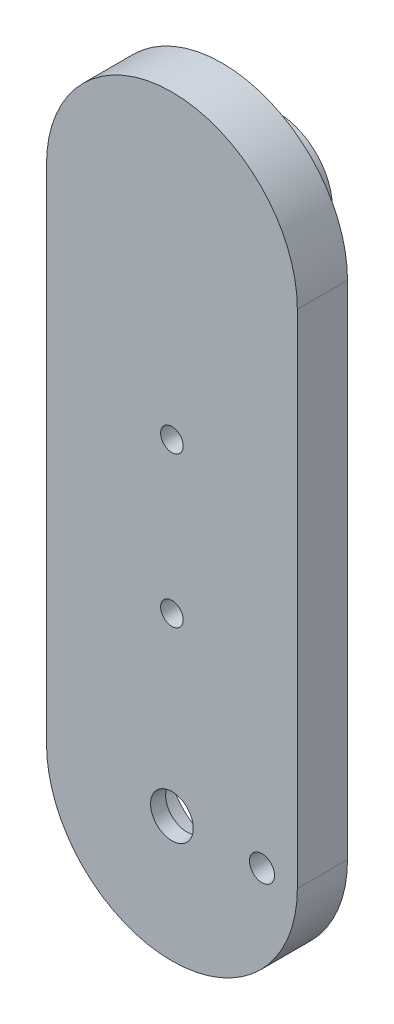
from build123d import *

# Parameters (mm, degrees)
CROQUIS1_R                   = 11
SALIENTE_EXTRUIR1_DEPTH      = 5
SALIENTE_EXTRUIR2_START      = 6
CROQUIS2_R                   = 11
SALIENTE_EXTRUIR2_DEPTH      = 6
CROQUIS3_R                   = 2.25
CORTAR_EXTRUIR1_DEPTH        = 20.052558883
SALIENTE_EXTRUIR3_DEPTH      = 5
SALIENTE_EXTRUIR3_DEPTH_BACK = 5
SALIENTE_EXTRUIR4_DEPTH      = 10
CROQUIS6_R                   = 2.25
CORTAR_EXTRUIR2_DEPTH        = 130.193653111
CROQUIS7_R                   = 10.9
CORTAR_EXTRUIR3_DEPTH        = 7
CROQUIS8_R                   = 4.25
CORTAR_EXTRUIR4_DEPTH        = 129.740048173
CROQUIS9_R                   = 2.5
CORTAR_EXTRUIR5_DEPTH        = 130.193653111


with BuildPart() as part:
    # Croquis1 → Saliente-Extruir1 (new, symmetric)
    with BuildSketch(Plane.XY):
        Circle(CROQUIS1_R)
        with BuildLine():
            Line((1.833030278, 2.5), (-1.833030278, 2.5))
            ThreePointArc((-1.833030278, 2.5), (0, -3.1), (1.833030278, 2.5))
        make_face(mode=Mode.SUBTRACT)
    extrude(amount=SALIENTE_EXTRUIR1_DEPTH, both=True)

    # Croquis2 → Saliente-Extruir2 (add)
    with BuildSketch(Plane.XY.offset(5).offset(SALIENTE_EXTRUIR2_START)):
        Circle(CROQUIS2_R)
    extrude(amount=-SALIENTE_EXTRUIR2_DEPTH)

    # Croquis3 → Cortar-Extruir1 (cut, through all)
    with BuildSketch(Plane(origin=(0, 0, 0), x_dir=(1, 0, 0), z_dir=(0, 1, 0))):
        with Locations(Location((0, 0, 0), (0, 0, 90))):
            Circle(CROQUIS3_R)
    extrude(amount=CORTAR_EXTRUIR1_DEPTH, mode=Mode.SUBTRACT)

    # Croquis4 → Saliente-Extruir3 (add, two sides: drawn at the far end of the back side and taken through both)
    with BuildSketch(Plane.XY.offset(11).offset(-SALIENTE_EXTRUIR3_DEPTH_BACK)):
        with BuildLine():
            Line((-25, 0), (-25, -85))
            Line((-25, -85), (25, -85))
            Line((25, -85), (25, 0))
            ThreePointArc((25, 0), (0, 25), (-25, 0))
        make_face()
    extrude(amount=SALIENTE_EXTRUIR3_DEPTH + SALIENTE_EXTRUIR3_DEPTH_BACK)

    # Croquis5 → Saliente-Extruir4 (add)
    with BuildSketch(Plane.XY.offset(16)):
        with BuildLine():
            Line((-25, -100), (-25, -85))
            Line((-25, -85), (25, -85))
            Line((25, -85), (25, -100))
            ThreePointArc((25, -100), (0, -125), (-25, -100))
        make_face()
    extrude(amount=-SALIENTE_EXTRUIR4_DEPTH)

    # Croquis6 → Cortar-Extruir2 (cut, through all)
    with BuildSketch(Plane.XY.offset(16)):
        with Locations((0, -35)):
            Circle(CROQUIS6_R)
        with Locations((0, -65)):
            Circle(CROQUIS6_R)
    extrude(amount=-CORTAR_EXTRUIR2_DEPTH, mode=Mode.SUBTRACT)

    # Croquis7 → Cortar-Extruir3 (cut)
    with BuildSketch(Plane(origin=(0, 0, 6), x_dir=(-1, 0, 0), z_dir=(0, 0, -1))):
        with Locations((0, -100)):
            Circle(CROQUIS7_R)
    extrude(amount=-CORTAR_EXTRUIR3_DEPTH, mode=Mode.SUBTRACT)

    # Croquis8 → Cortar-Extruir4 (cut, through all)
    with BuildSketch(Plane(origin=(0, 0, 13), x_dir=(-1, 0, 0), z_dir=(0, 0, -1))):
        with Locations((0, -100)):
            Circle(CROQUIS8_R)
    extrude(amount=-CORTAR_EXTRUIR4_DEPTH, mode=Mode.SUBTRACT)

    # Croquis9 → Cortar-Extruir5 (cut, through all)
    with BuildSketch(Plane.XY.offset(16)):
        with Locations((17.95, -100)):
            Circle(CROQUIS9_R)
    extrude(amount=-CORTAR_EXTRUIR5_DEPTH, mode=Mode.SUBTRACT)


solid = part.part
